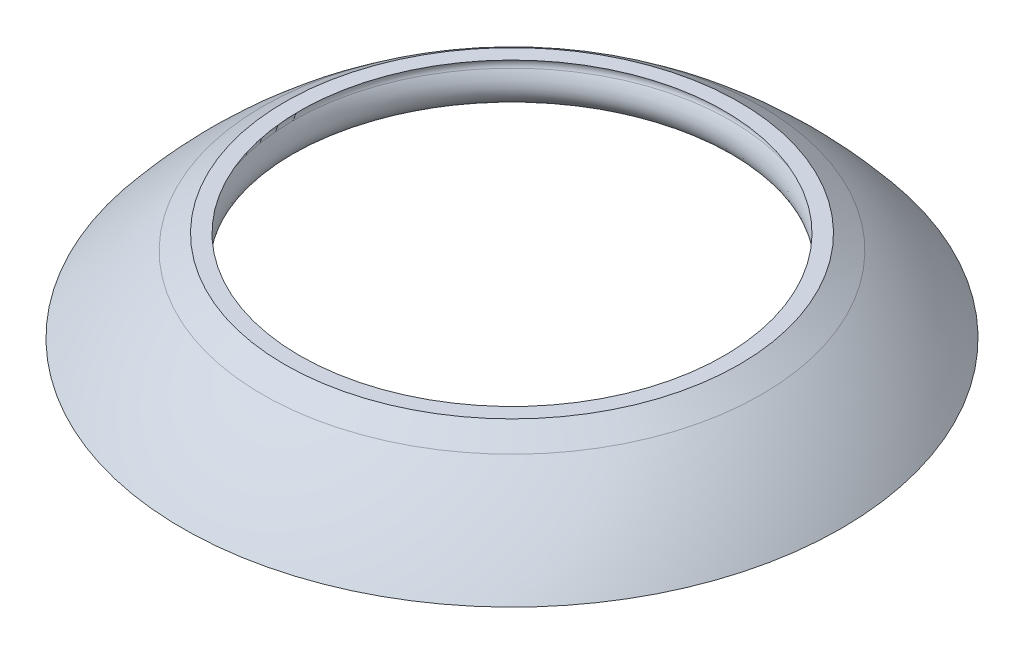
from build123d import *


with BuildPart() as part:
    # Sketch6 (on Front Plane) → iris (revolve)
    with BuildSketch(Plane.XY):
        with BuildLine():
            Line((5.492861113, 4.08), (5.886123402, 4.08))
            Line((5.886123402, 4.08), (6.45968041, 3.692562089))
            ThreePointArc((6.45968041, 3.692562089), (7.559948173, 2.778801061), (8.532298411, 1.729952463))
            add(Edge.make_bspline(
                [(5.66447834, 3.777298844), (5.52797511, 3.549197167), (5.417228742, 2.854359981), (6.983816782, 2.521940583), (8.08067984, 1.917370456), (8.532298411, 1.729952463)],
                knots=[0.065550843, 0.065550843, 0.065550843, 0.065550843, 0.226972151, 0.688222094, 1, 1, 1, 1], degree=3))
            ThreePointArc((5.66447834, 3.777298844), (5.666844203, 3.978640177), (5.492861113, 4.08))
        make_face()
    revolve(axis=Axis((0, 4.465667959, 0), (0, -1, 0)))

    # Sketch6 (on Front Plane) → ciliary body (revolve)
    with BuildSketch(Plane.XY):
        with BuildLine():
            Line((5.492861113, 4.08), (5.886123402, 4.08))
            Line((5.886123402, 4.08), (6.45968041, 3.692562089))
            ThreePointArc((6.45968041, 3.692562089), (7.559948173, 2.778801061), (8.532298411, 1.729952463))
            add(Edge.make_bspline(
                [(5.66447834, 3.777298844), (5.52797511, 3.549197167), (5.417228742, 2.854359981), (6.983816782, 2.521940583), (8.08067984, 1.917370456), (8.532298411, 1.729952463)],
                knots=[0.065550843, 0.065550843, 0.065550843, 0.065550843, 0.226972151, 0.688222094, 1, 1, 1, 1], degree=3))
            ThreePointArc((5.66447834, 3.777298844), (5.666844203, 3.978640177), (5.492861113, 4.08))
        make_face()
    revolve(axis=Axis((0, 4.465667959, 0), (0, -1, 0)))


solid = part.part
